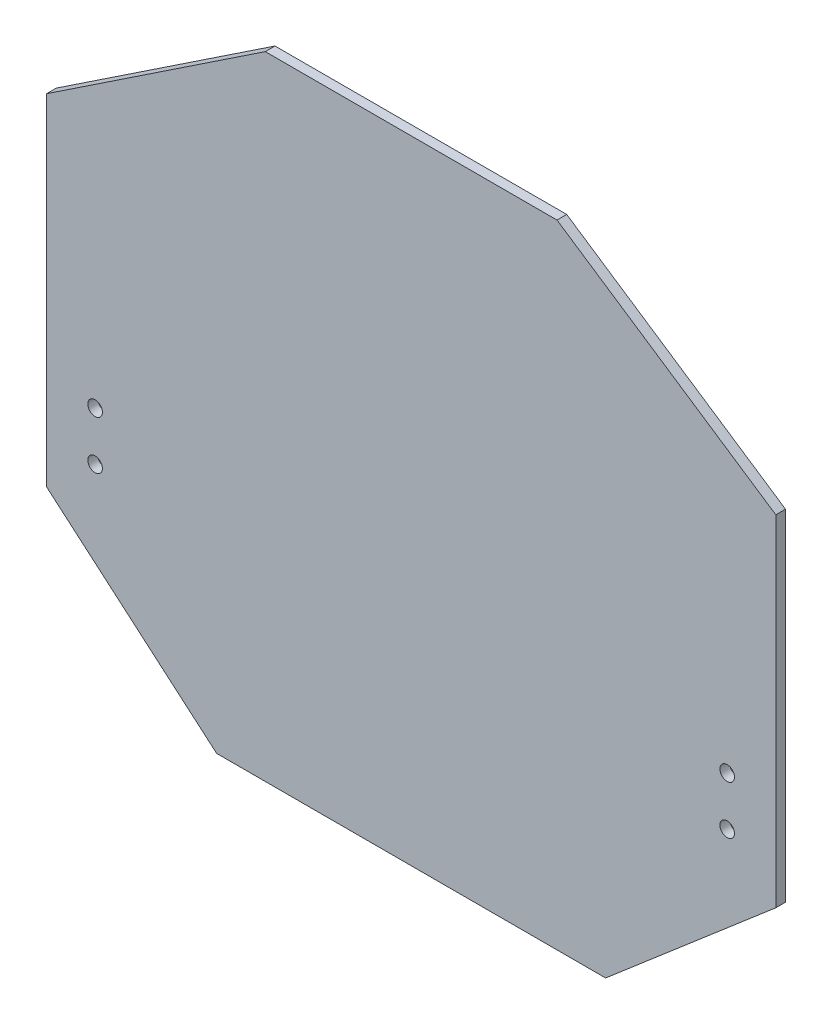
from build123d import *

# Parameters (mm, degrees)
SKETCH_1_R      = 1.5
EXTRUDE_1_DEPTH = 2


with BuildPart() as part:
    # 草图1 → 凸台-拉伸1 (new body)
    with BuildSketch(Plane.XY):
        Polygon((-75, 0), (-75, 70), (-30, 100), (30, 100), (75, 70), (75, 0), (40, -30), (-40, -30), align=None)
        with Locations((-65, 9)):
            Circle(SKETCH_1_R, mode=Mode.SUBTRACT)
        with Locations(Location((65, 9, 0), (0, 0, 180))):
            Circle(SKETCH_1_R, mode=Mode.SUBTRACT)
        with Locations((-65, 19)):
            Circle(SKETCH_1_R, mode=Mode.SUBTRACT)
        with Locations(Location((65, 19, 0), (0, 0, 180))):
            Circle(SKETCH_1_R, mode=Mode.SUBTRACT)
    extrude(amount=EXTRUDE_1_DEPTH)


solid = part.part
